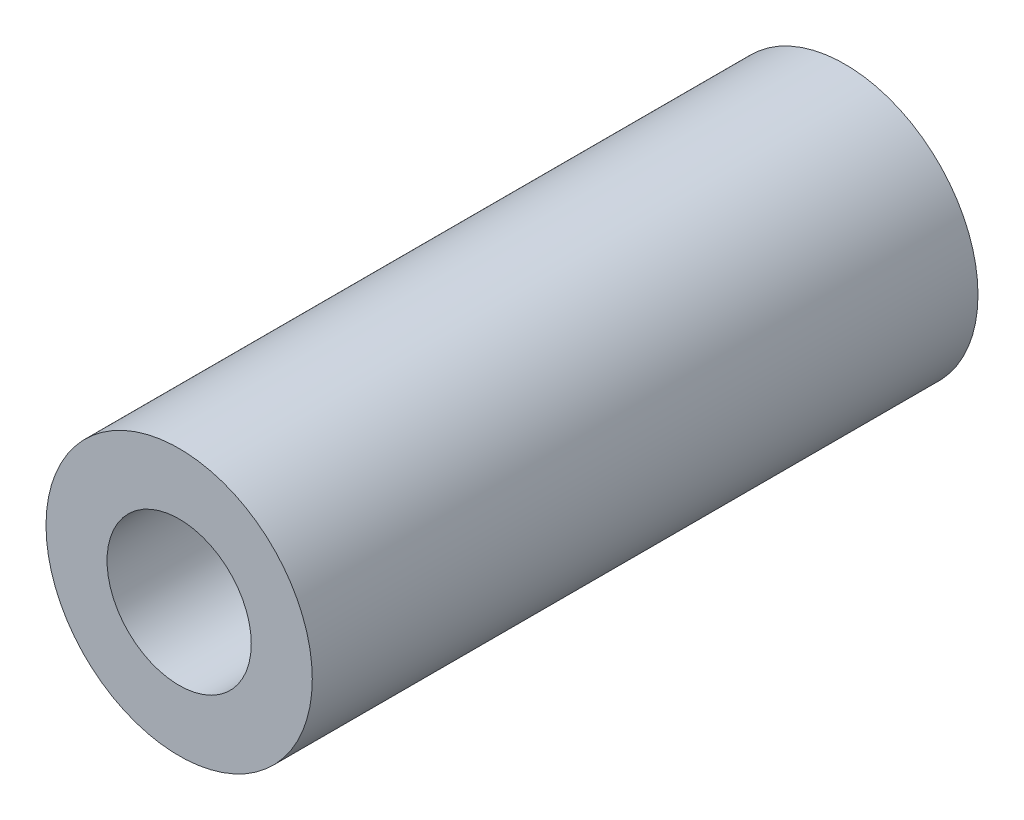
from build123d import *

# Parameters (mm, degrees)
SKETCH1_R           = 6
SKETCH1_R_2         = 3.25
BOSS_EXTRUDE1_DEPTH = 30


with BuildPart() as part:
    # Sketch1 → Boss-Extrude1 (new body)
    with BuildSketch(Plane(origin=(0, 0, 0), x_dir=(0, 1, 0), z_dir=(0, 0, 1))):
        with Locations(Location((0, 0, 0), (0, 0, 270))):
            Circle(SKETCH1_R)
        with Locations(Location((0, 0, 0), (0, 0, 270))):
            Circle(SKETCH1_R_2, mode=Mode.SUBTRACT)
    extrude(amount=BOSS_EXTRUDE1_DEPTH)


solid = part.part
